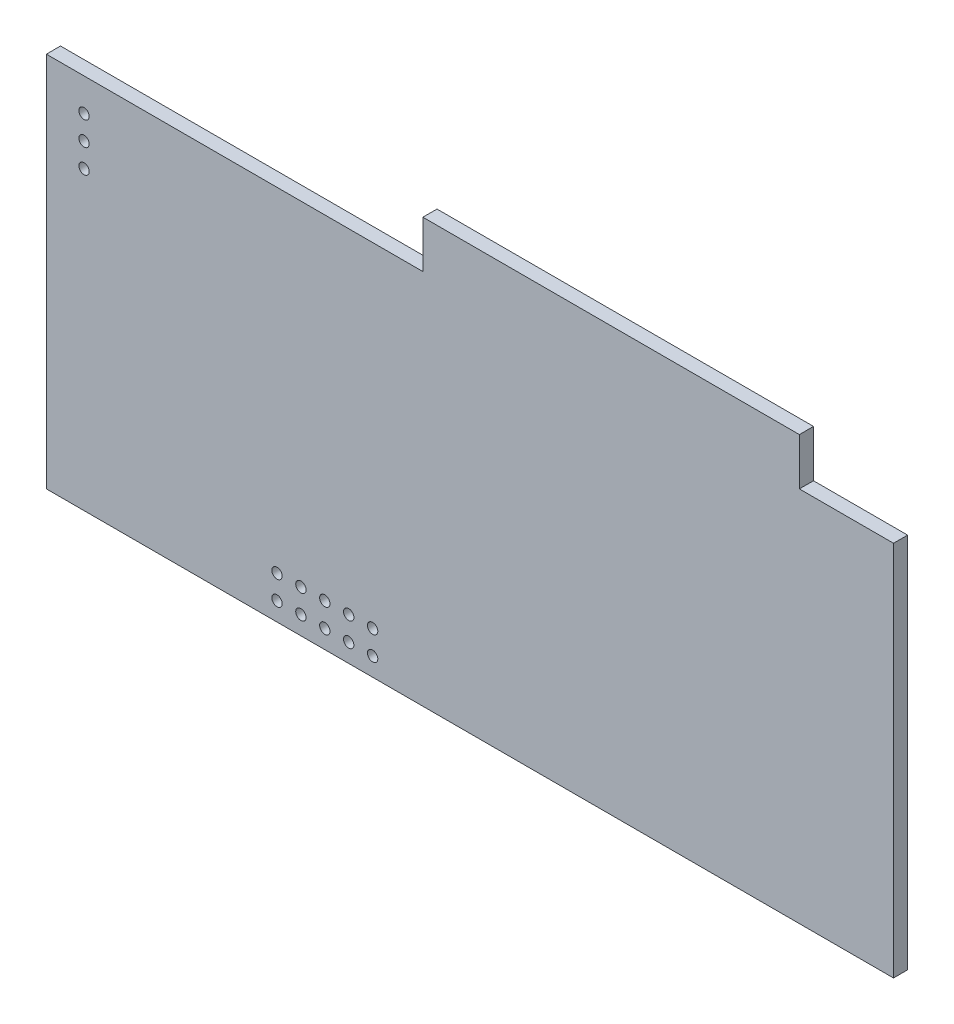
from build123d import *

# Parameters (mm, degrees)
EXTRUDE_1_DEPTH     = 1.5
SKETCH_2_R          = 0.55
CUT_EXTRUDE_1_DEPTH = 1.5


with BuildPart() as part:
    # Эскиз1 → Вытянуть1 (new body)
    with BuildSketch(Plane.XY):
        Polygon((0, 20), (0, 25), (40, 25), (40, 20), (50, 20), (50, -20), (-40, -20), (-40, 20), align=None)
    extrude(amount=EXTRUDE_1_DEPTH)

    # Эскиз2 → Вырез-Вытянуть1 (cut)
    with BuildSketch(Plane.XY.offset(1.5)):
        with Locations((-36, 16.54)):
            Circle(SKETCH_2_R)
        with Locations((-36, 11.46)):
            Circle(SKETCH_2_R)
        with Locations((-36, 14)):
            Circle(SKETCH_2_R)
        with Locations((-15.5, -15.5)):
            Circle(SKETCH_2_R)
        with Locations((-15.5, -18.04)):
            Circle(SKETCH_2_R)
        with Locations((-12.96, -15.5)):
            Circle(SKETCH_2_R)
        with Locations((-12.96, -18.04)):
            Circle(SKETCH_2_R)
        with Locations((-10.42, -15.5)):
            Circle(SKETCH_2_R)
        with Locations((-10.42, -18.04)):
            Circle(SKETCH_2_R)
        with Locations((-7.88, -15.5)):
            Circle(SKETCH_2_R)
        with Locations((-7.88, -18.04)):
            Circle(SKETCH_2_R)
        with Locations((-5.34, -15.5)):
            Circle(SKETCH_2_R)
        with Locations((-5.34, -18.04)):
            Circle(SKETCH_2_R)
    extrude(amount=-CUT_EXTRUDE_1_DEPTH, mode=Mode.SUBTRACT)


solid = part.part
